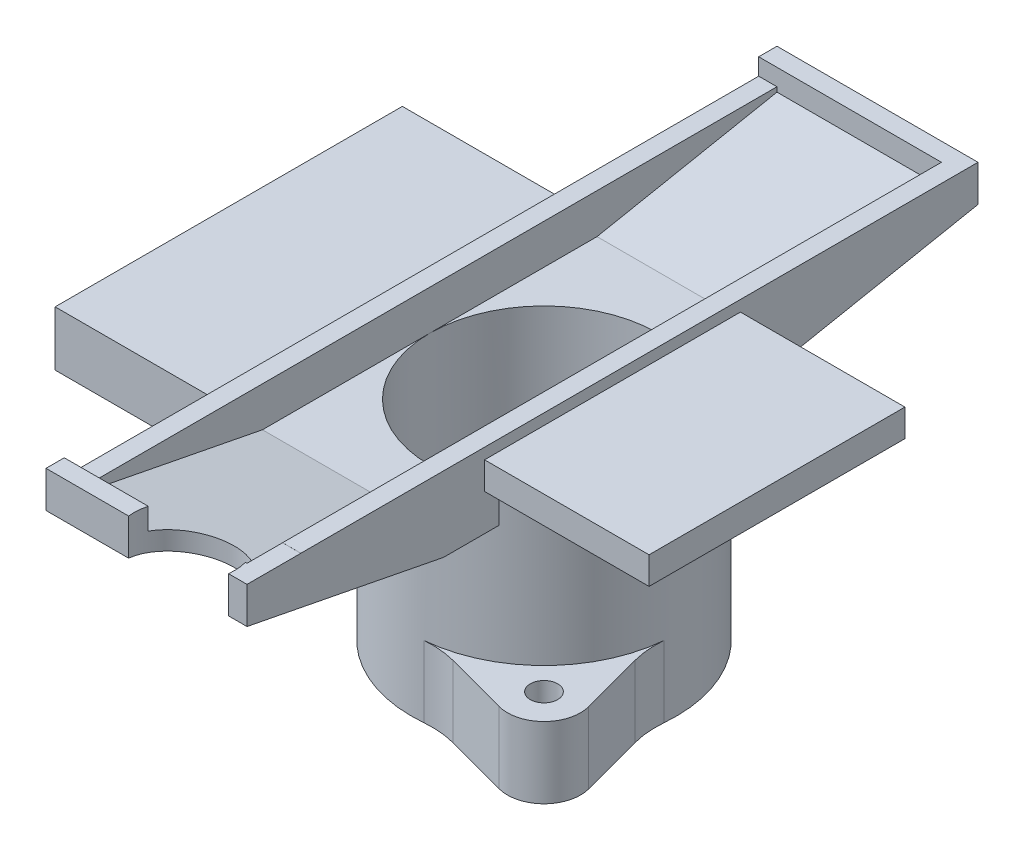
from build123d import *
from build123d.topology import SkipClean

# Parameters (mm, degrees)
SKETCH_1_R               = 12.5
SKETCH_1_R_2             = 1.5
EXTRUDE_1_DEPTH          = 5
SKETCH_2_R               = 12.5
EXTRUDE_2_DEPTH          = 15
EXTRUDE_4_DEPTH          = 22
EXTRUDE_5_DEPTH          = 2
SKETCH_11_W              = 34.855942827
SKETCH_11_H              = 38
EXTRUDE_7_DEPTH          = 3
CUT_EXTRUDE_2_DEPTH      = 240.812701315
CUT_EXTRUDE_2_DEPTH_BACK = 240.812701315
CUT_EXTRUDE_3_DEPTH      = 9
CUT_EXTRUDE_4_REACH      = 226.407
EXTRUDE_START            = 2.8
SKETCH_12_R              = 12.5
SKETCH_12_R_2            = 1.5
EXTRUDE_8_DEPTH          = 2.8
SKETCH_10_W              = 18
SKETCH_10_H              = 28
EXTRUDE_6_DEPTH          = 3
SKETCH_4_R               = 5.5
CUT_EXTRUDE_1_DEPTH      = 10


with BuildPart() as part:
    # 草圖1 → 填料-伸長1 (new body)
    with BuildSketch(Plane(origin=(0, 5.156954032, 0), x_dir=(1, 0, 0), z_dir=(0, 1, 0))):
        with BuildLine():
            ThreePointArc((-44.792972571, -181.302345222), (-44.796491977, -183.058763578), (-44.492647899, -184.788704792))
            Line((-44.492647899, -184.788704792), (-42.64274246, -191.692645881))
            ThreePointArc((-42.64274246, -191.692645881), (-43.67801864, -195.556349186), (-47.541721945, -196.591625367))
            Line((-47.541721945, -196.591625367), (-54.445663034, -194.741719927))
            ThreePointArc((-54.445663034, -194.741719927), (-56.175604248, -194.43787585), (-57.932022604, -194.441395255))
            ThreePointArc((-57.932022604, -194.441395255), (-69.487416154, -190.253048327), (-73.675763082, -178.697654778))
            ThreePointArc((-73.675763082, -178.697654778), (-73.672243676, -176.941236422), (-73.976087754, -175.211295208))
            Line((-73.976087754, -175.211295208), (-75.825993193, -168.307354119))
            ThreePointArc((-75.825993193, -168.307354119), (-74.790717013, -164.443650814), (-70.927013707, -163.408374633))
            Line((-70.927013707, -163.408374633), (-64.023072619, -165.258280073))
            ThreePointArc((-64.023072619, -165.258280073), (-62.293131405, -165.56212415), (-60.536713049, -165.558604745))
            ThreePointArc((-60.536713049, -165.558604745), (-48.981319499, -169.746951673), (-44.792972571, -181.302345222))
        make_face()
        with Locations(Location((-59.234367826, -180, 0), (0, 0, 270))):
            Circle(SKETCH_1_R, mode=Mode.SUBTRACT)
        with Locations(Location((-71.962289888, -167.272077939, 0), (0, 0, 270))):
            Circle(SKETCH_1_R_2, mode=Mode.SUBTRACT)
        with Locations(Location((-46.506445765, -192.727922061, 0), (0, 0, 270))):
            Circle(SKETCH_1_R_2, mode=Mode.SUBTRACT)
    extrude(amount=EXTRUDE_1_DEPTH)

    # 草圖2 → 填料-伸長2 (add)
    with SkipClean():  # the faces are left unmerged after this step: merging them gives an invalid solid
        with BuildSketch(Plane(origin=(0, 10.156954032, 0), x_dir=(1, 0, 0), z_dir=(0, 1, 0))):
            with BuildLine():
                ThreePointArc((-57.932022604, -194.441395255), (-57.58271092, -194.405624924), (-57.234367826, -194.361406616))
                ThreePointArc((-57.234367826, -194.361406616), (-48.736051742, -190.001767813), (-44.792972571, -181.302345222))
                ThreePointArc((-44.792972571, -181.302345222), (-44.749026422, -180.651831572), (-44.734367826, -180))
                ThreePointArc((-44.734367826, -180), (-48.297046399, -170.480283618), (-57.234367826, -165.638593384))
                ThreePointArc((-57.234367826, -165.638593384), (-58.883255177, -165.504251661), (-60.536713049, -165.558604745))
                ThreePointArc((-60.536713049, -165.558604745), (-69.487416154, -169.746951673), (-73.675763082, -178.697654778))
                ThreePointArc((-73.675763082, -178.697654778), (-69.487416154, -190.253048327), (-57.932022604, -194.441395255))
            make_face()
            with Locations(Location((-59.234367826, -180, 0), (0, 0, 270))):
                Circle(SKETCH_2_R, mode=Mode.SUBTRACT)
        extrude(amount=EXTRUDE_2_DEPTH)

    # 草圖3 → 填料-伸長4 (add)
    with SkipClean():  # the faces are left unmerged after this step: merging them gives an invalid solid
        with BuildSketch(Plane.ZY.offset(73.734367826)):
            Polygon((220, 27.352075983), (220, 31.351675277), (214.110829696, 31.351675277), (214.110829696, 31.356954032), (140, 31.356954032), (140, 27.356954032), (161.5, 23.156954032), (180, 23.156954032), (198.5, 23.156954032), align=None)
        extrude(amount=-EXTRUDE_4_DEPTH)

    # 草圖5 → 填料-伸長5 (add)
    with SkipClean():  # the faces are left unmerged after this step: merging them gives an invalid solid
        with BuildSketch(Plane(origin=(0, 25.156954032, 0), x_dir=(1, 0, 0), z_dir=(0, 1, 0))):
            with BuildLine():
                Line((-51.734367826, -192.409673646), (-51.734367826, -167.590326354))
                ThreePointArc((-51.734367826, -167.590326354), (-44.734367826, -180), (-51.734367826, -192.409673646))
            make_face()
        extrude(amount=EXTRUDE_5_DEPTH)

    # 草圖11 → 填料-伸長7 (add, symmetric)
    with SkipClean():  # the faces are left unmerged after this step: merging them gives an invalid solid
        with BuildSketch(Plane.XZ.offset(-23.156954032)):
            with Locations((-76.306396413, 180)):
                Rectangle(SKETCH_11_W, SKETCH_11_H)
        extrude(amount=EXTRUDE_7_DEPTH, both=True)

    # 草圖6 → 除料-伸長2 (cut, two sides: drawn at the far end of the back side and taken through both)
    with SkipClean():  # the faces are left unmerged after this step: merging them gives an invalid solid
        with BuildSketch(Plane.XZ.offset(-23.156954032).offset(-CUT_EXTRUDE_2_DEPTH_BACK)):
            with BuildLine():
                Line((-53.734367826, 168.77502784), (-53.734367826, 191.22497216))
                ThreePointArc((-53.734367826, 191.22497216), (-71.734367826, 180), (-53.734367826, 168.77502784))
            make_face()
        extrude(amount=CUT_EXTRUDE_2_DEPTH + CUT_EXTRUDE_2_DEPTH_BACK, mode=Mode.SUBTRACT)

    # 草圖7 → 除料-伸長3 (cut, symmetric)
    with SkipClean():  # the faces are left unmerged after this step: merging them gives an invalid solid
        with BuildSketch(Plane.ZY.offset(62.734367826)):
            Polygon((218, 29.351675277), (218, 40.942624065), (142, 40.942624065), (142, 29.356954032), (142, 29.004060242), (161.693519886, 25.156954032), (180, 25.156954032), (198.306700713, 25.156954032), (218, 28.999549015), align=None)
        extrude(amount=CUT_EXTRUDE_3_DEPTH, both=True, mode=Mode.SUBTRACT)

    # 草圖9 → 除料-伸長4 (cut, up to next)
    with BuildSketch(Plane.ZY.offset(73.734367826), mode=Mode.PRIVATE) as cut_extrude_4_sk1:
        Polygon((142, 31.523455744), (142, 29.51817699), (218, 29.51817699), (218, 31.51817699), align=None)
    cut_extrude_4_tool1 = extrude(cut_extrude_4_sk1.sketch, amount=-CUT_EXTRUDE_4_REACH, mode=Mode.PRIVATE) & part.part
    add(cut_extrude_4_tool1.solids().sort_by_distance((-73.734368, 30.519497, 179.983306))[0], mode=Mode.SUBTRACT)

    # 草圖12 → 填料-伸長8 (add)
    with SkipClean():  # the faces are left unmerged after this step: merging them gives an invalid solid
        with BuildSketch(Plane.XZ.offset(-5.156954032).offset(EXTRUDE_START)):
            with BuildLine():
                Line((-44.492647899, 184.788704792), (-42.64274246, 191.692645881))
                ThreePointArc((-42.64274246, 191.692645881), (-43.67801864, 195.556349186), (-47.541721945, 196.591625367))
                Line((-47.541721945, 196.591625367), (-54.445663034, 194.741719927))
                ThreePointArc((-54.445663034, 194.741719927), (-56.175604248, 194.43787585), (-57.932022604, 194.441395255))
                ThreePointArc((-57.932022604, 194.441395255), (-69.487416154, 190.253048327), (-73.675763082, 178.697654778))
                ThreePointArc((-73.675763082, 178.697654778), (-73.672243676, 176.941236422), (-73.976087754, 175.211295208))
                Line((-73.976087754, 175.211295208), (-75.825993193, 168.307354119))
                ThreePointArc((-75.825993193, 168.307354119), (-74.790717013, 164.443650814), (-70.927013707, 163.408374633))
                Line((-70.927013707, 163.408374633), (-64.023072619, 165.258280073))
                ThreePointArc((-64.023072619, 165.258280073), (-62.293131405, 165.56212415), (-60.536713049, 165.558604745))
                ThreePointArc((-60.536713049, 165.558604745), (-48.981319499, 169.746951673), (-44.792972571, 181.302345222))
                ThreePointArc((-44.792972571, 181.302345222), (-44.796491977, 183.058763578), (-44.492647899, 184.788704792))
            make_face()
            with Locations(Location((-59.234367826, 180, 0), (0, 0, 270))):
                Circle(SKETCH_12_R, mode=Mode.SUBTRACT)
            with Locations(Location((-71.962289888, 167.272077939, 0), (0, 0, 270))):
                Circle(SKETCH_12_R_2, mode=Mode.SUBTRACT)
            with Locations(Location((-46.506445765, 192.727922061, 0), (0, 0, 270))):
                Circle(SKETCH_12_R_2, mode=Mode.SUBTRACT)
        extrude(amount=-EXTRUDE_8_DEPTH)

    # 草圖10 → 填料-伸長6 (add)
    with SkipClean():  # the faces are left unmerged after this step: merging them gives an invalid solid
        with BuildSketch(Plane(origin=(0, 27.156954032, 0), x_dir=(1, 0, 0), z_dir=(0, 1, 0))):
            with Locations((-42.734367826, -180)):
                Rectangle(SKETCH_10_W, SKETCH_10_H)
        extrude(amount=EXTRUDE_6_DEPTH)

    # 草圖4 → 除料-伸長1 (cut)
    with SkipClean():  # the faces are left unmerged after this step: merging them gives an invalid solid
        with BuildSketch(Plane(origin=(0, 31.351675277, 0), x_dir=(1, 0, 0), z_dir=(0, 1, 0))):
            with Locations((-59.226743272, -219.402909175)):
                Circle(SKETCH_4_R)
        extrude(amount=-CUT_EXTRUDE_1_DEPTH, mode=Mode.SUBTRACT)


solid = part.part
